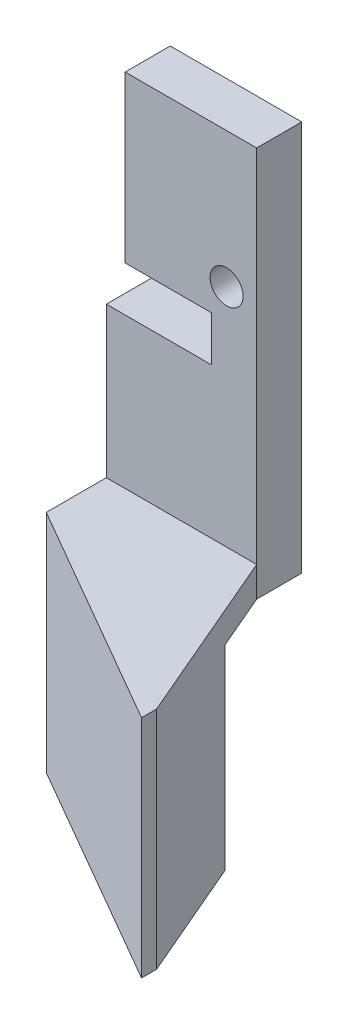
from build123d import *

# Parameters (mm, degrees)
SKETCH1_R           = 1.1
BOSS_EXTRUDE1_DEPTH = 3
SKETCH2_W           = 10
SKETCH2_H           = 25
BOSS_EXTRUDE2_DEPTH = 3
SKETCH3_W           = 5
SKETCH3_H           = 3
SKETCH3_W_2         = 10
BOSS_EXTRUDE3_DEPTH = 15
CUT_EXTRUDE1_DEPTH  = 15
CUT_EXTRUDE3_DEPTH  = 13


with BuildPart() as part:
    # Sketch1 → Boss-Extrude1 (new body)
    with BuildSketch(Plane.XY):
        Polygon((4.875, 7), (-3.875, 7), (-3.875, -4), (1.875, -4), (1.875, -7), (4.875, -7), align=None)
        with Locations((2.875, -2)):
            Circle(SKETCH1_R, mode=Mode.SUBTRACT)
    extrude(amount=BOSS_EXTRUDE1_DEPTH)

    # Sketch2 → Boss-Extrude2 (add)
    with BuildSketch(Plane.XY.offset(3)):
        with Locations((-0.125, -19.5)):
            Rectangle(SKETCH2_W, SKETCH2_H)
    extrude(amount=-BOSS_EXTRUDE2_DEPTH)

    # Sketch3 → Boss-Extrude3 (add)
    with BuildSketch(Plane(origin=(0, -32, 0), x_dir=(-1, 0, 0), z_dir=(0, -1, 0))):
        Polygon((-9.875, -11.660254038), (5.125, -3), (-4.875, -3), (-9.875, -3), align=None)
        with Locations((-7.375, -1.5)):
            Rectangle(SKETCH3_W, SKETCH3_H)
        with Locations((0.125, -1.5)):
            Rectangle(SKETCH3_W_2, SKETCH3_H)
        Polygon((5.125, -7), (-9.875, -15.660254038), (-9.875, -11.660254038), (5.125, -3), align=None)
    extrude(amount=-BOSS_EXTRUDE3_DEPTH)

    # Sketch5 → Cut-Extrude1 (cut)
    with BuildSketch(Plane(origin=(0, -17, 0), x_dir=(1, 0, 0), z_dir=(0, 1, 0))):
        Polygon((9.875, -14.660254038), (4.875, -3), (4.875, 0), (9.875, 0), align=None)
    extrude(amount=-CUT_EXTRUDE1_DEPTH, mode=Mode.SUBTRACT)

    # Sketch6 → Cut-Extrude3 (cut)
    with BuildSketch(Plane(origin=(0, -32, 0), x_dir=(-1, 0, 0), z_dir=(0, -1, 0))):
        Polygon((-6.45561312, -6.686070102), (5.125, 0), (-4.875, 0), (-4.875, -3), align=None)
    extrude(amount=-CUT_EXTRUDE3_DEPTH, mode=Mode.SUBTRACT)


solid = part.part
